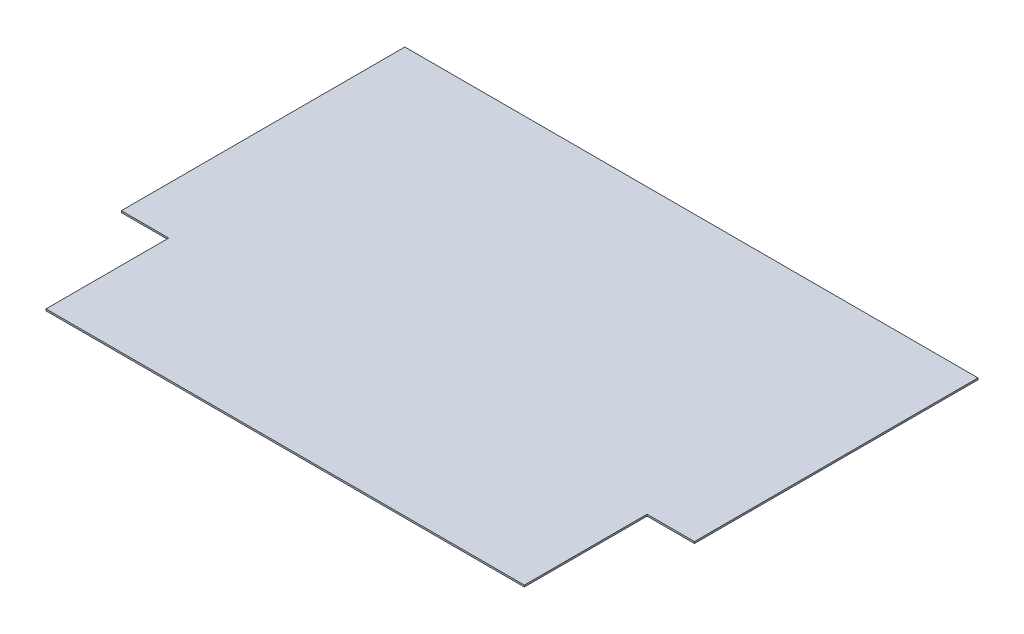
from build123d import *

# Parameters (mm, degrees)
BOSS_EXTRUDE1_DEPTH = 6.35
SKETCH2_W           = 177.8
SKETCH2_H           = 460.375
CUT_EXTRUDE1_DEPTH  = 3371.575045223
SKETCH3_W           = 2150.099514553
SKETCH3_H           = 1524
CUT_EXTRUDE2_DEPTH  = 3371.575045223


with BuildPart() as part:
    # Sketch1 → Boss-Extrude1 (new body)
    with BuildSketch(Plane(origin=(0, 0, 0), x_dir=(1, 0, 0), z_dir=(0, 1, 0))):
        Polygon((-914.4, 0), (914.4, 0), (914.4, 3048), (-914.4, 3048), (-1438.899514553, 3048), (-1438.899514553, 0), align=None)
    extrude(amount=BOSS_EXTRUDE1_DEPTH)

    # Sketch2 → Cut-Extrude1 (cut, through all)
    with BuildSketch(Plane(origin=(0, 6.35, 0), x_dir=(1, 0, 0), z_dir=(0, 1, 0))):
        Polygon((914.4, 0), (533.4, 0), (533.4, 460.375), (711.2, 460.375), (711.2, 2587.625), (533.4, 2587.625), (533.4, 3048), (914.4, 3048), (914.4, 2587.625), (914.4, 460.375), align=None)
        with Locations((-1349.999514553, 230.1875)):
            Rectangle(SKETCH2_W, SKETCH2_H)
        with Locations((-1349.999514553, 2817.8125)):
            Rectangle(SKETCH2_W, SKETCH2_H)
    extrude(amount=-CUT_EXTRUDE1_DEPTH, mode=Mode.SUBTRACT)

    # Sketch3 → Cut-Extrude2 (cut, through all)
    with BuildSketch(Plane(origin=(0, 6.35, 0), x_dir=(1, 0, 0), z_dir=(0, 1, 0))):
        with Locations((-363.849757276, 2286)):
            Rectangle(SKETCH3_W, SKETCH3_H)
    extrude(amount=-CUT_EXTRUDE2_DEPTH, mode=Mode.SUBTRACT)


solid = part.part
